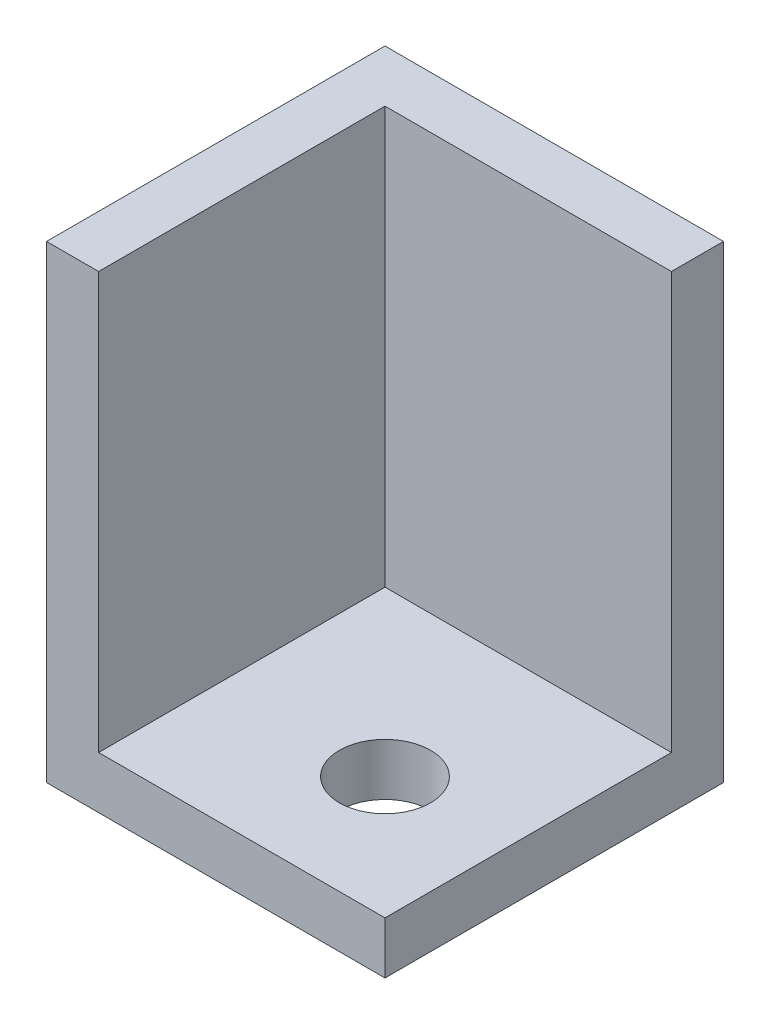
from build123d import *

# Parameters (mm, degrees)
SKETCH1_W           = 13
SKETCH1_H           = 13
BOSS_EXTRUDE1_DEPTH = 2
BOSS_EXTRUDE2_DEPTH = 16
SKETCH3_R           = 1.75
CUT_EXTRUDE1_DEPTH  = 20


with BuildPart() as part:
    # Sketch1 → Boss-Extrude1 (new body)
    with BuildSketch(Plane(origin=(0, 0, 0), x_dir=(1, 0, 0), z_dir=(0, 1, 0))):
        Rectangle(SKETCH1_W, SKETCH1_H)
    extrude(amount=BOSS_EXTRUDE1_DEPTH)

    # Sketch2 → Boss-Extrude2 (add)
    with BuildSketch(Plane(origin=(0, 2, 0), x_dir=(1, 0, 0), z_dir=(0, 1, 0))):
        Polygon((-6.5, 6.5), (-6.5, -6.5), (-4.5, -6.5), (-4.5, 4.5), (6.5, 4.5), (6.5, 6.5), align=None)
    extrude(amount=BOSS_EXTRUDE2_DEPTH)

    # Sketch3 → Cut-Extrude1 (cut)
    with BuildSketch(Plane(origin=(0, 2, 0), x_dir=(1, 0, 0), z_dir=(0, 1, 0))):
        with Locations(Location((1.8, -1.8, 0), (0, 0, 270))):
            Circle(SKETCH3_R)
    extrude(amount=-CUT_EXTRUDE1_DEPTH, mode=Mode.SUBTRACT)


solid = part.part
